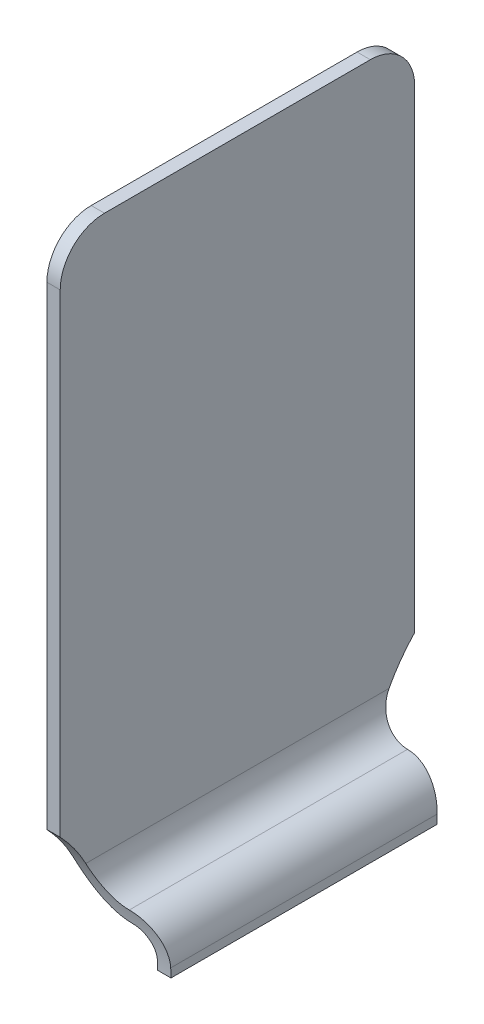
from build123d import *

# Parameters (mm, degrees)
EXTRUDE_THIN1_DEPTH     = 101.6
FILLET1_R               = 25.4
FILLET2_R               = 25.4
CUT_EXTRUDE1_DEPTH      = 10.922
CUT_EXTRUDE1_DEPTH_BACK = 54.61


with BuildPart() as part:
    # Sketch1 → Extrude-Thin1 (new, symmetric)
    with BuildSketch(Plane.XY):
        with BuildLine():
            Line((0, 0), (0, 5.08))
            ThreePointArc((0, 5.08), (-3.719743879, 14.060256121), (-12.7, 17.78))
            ThreePointArc((-12.7, 17.78), (-30.660512242, 25.219487758), (-38.1, 43.18))
            Line((-38.1, 43.18), (-38.1, 360.68))
            Line((-38.1, 360.68), (-30.48, 360.68))
            Line((-30.48, 360.68), (-30.48, 43.18))
            ThreePointArc((-30.48, 43.18), (-25.272358569, 30.607641431), (-12.7, 25.4))
            ThreePointArc((-12.7, 25.4), (1.668409794, 19.448409794), (7.62, 5.08))
            Line((7.62, 5.08), (7.62, 0))
            Line((7.62, 0), (0, 0))
        make_face()
    extrude(amount=EXTRUDE_THIN1_DEPTH, both=True)

    # Fillet1
    fillet1_edges = [part.edges().sort_by_distance(p)[0] for p in [
        (-34.29, 360.68, 101.6),
    ]]
    fillet(fillet1_edges, radius=FILLET1_R)

    # Fillet2
    fillet2_edges = [part.edges().sort_by_distance(p)[0] for p in [
        (-34.29, 360.68, -101.6),
    ]]
    fillet(fillet2_edges, radius=FILLET2_R)

    # Sketch3 → Cut-Extrude1 (cut, two sides: drawn at the far end of the back side and taken through both)
    with BuildSketch(Plane(origin=(7.62, 0, 0), x_dir=(0, 0, -1), z_dir=(1, 0, 0)).offset(-CUT_EXTRUDE1_DEPTH_BACK)):
        with BuildLine():
            Line((-101.6, 0), (-101.6, 63.533291796))
            ThreePointArc((-101.6, 63.533291796), (-82.785279567, 34.211252412), (-76.2, 0))
            Line((-76.2, 0), (-101.6, 0))
        make_face()
        with BuildLine():
            Line((101.6, 0), (76.2, 0))
            ThreePointArc((76.2, 0), (82.785279567, 34.211252412), (101.6, 63.533291796))
            Line((101.6, 63.533291796), (101.6, 0))
        make_face()
    extrude(amount=CUT_EXTRUDE1_DEPTH + CUT_EXTRUDE1_DEPTH_BACK, mode=Mode.SUBTRACT)


solid = part.part
